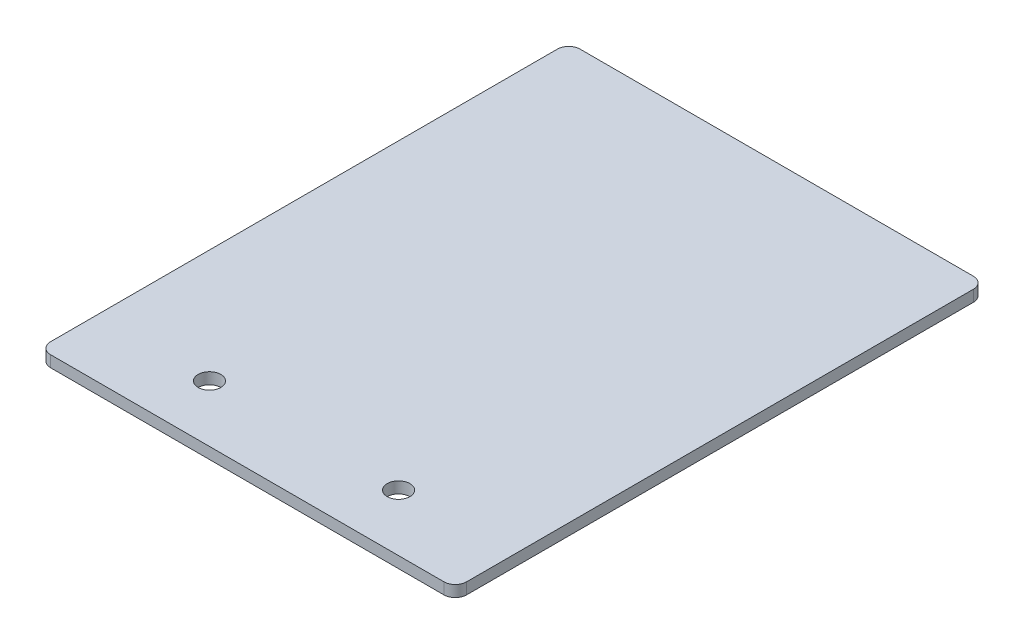
from build123d import *

# Parameters (mm, degrees)
SKETCH_1_W          = 110
SKETCH_1_H          = 140
EXTRUDE_1_DEPTH     = 3
SKETCH_2_R          = 3
CUT_EXTRUDE_1_DEPTH = 3
FILLET_1_R          = 3


with BuildPart() as part:
    # 草图1 → 凸台-拉伸1 (new body)
    with BuildSketch(Plane(origin=(0, 0, 0), x_dir=(1, 0, 0), z_dir=(0, 1, 0))):
        Rectangle(SKETCH_1_W, SKETCH_1_H)
    extrude(amount=EXTRUDE_1_DEPTH)

    # 草图2 → 切除-拉伸1 (cut)
    with BuildSketch(Plane.XZ):
        with Locations(Location((-25, 55, 0), (0, 0, 270))):
            Circle(SKETCH_2_R)
        with Locations(Location((25, 55, 0), (0, 0, 90))):
            Circle(SKETCH_2_R)
    extrude(amount=-CUT_EXTRUDE_1_DEPTH, mode=Mode.SUBTRACT)

    # 圆角1
    fillet_1_edges = [part.edges().sort_by_distance(p)[0] for p in [
        (55, 1.5, 70),
        (-55, 1.5, 70),
        (-55, 1.5, -70),
        (55, 1.5, -70),
    ]]
    fillet(fillet_1_edges, radius=FILLET_1_R)


solid = part.part
